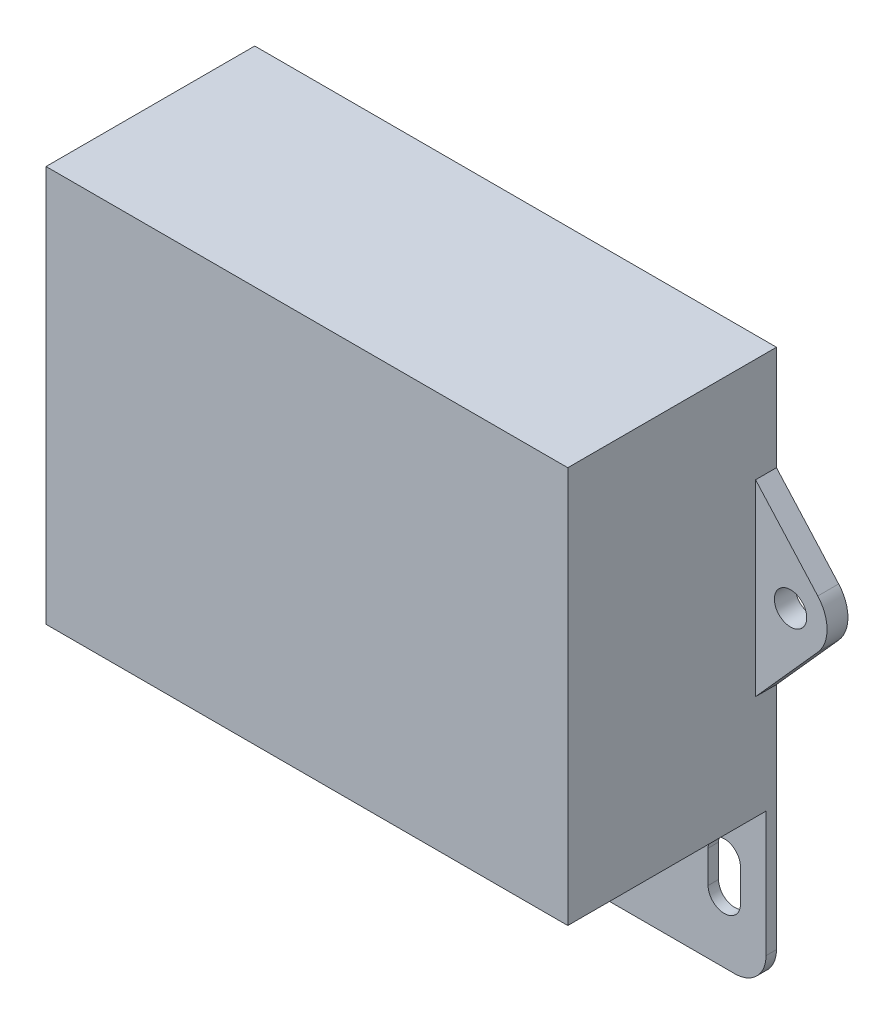
from build123d import *

# Parameters (mm, degrees)
SKETCH1_W                  = 50
SKETCH1_H                  = 38
MAIN_BODY_DEPTH            = 10
SIDE_MOUNTING_BODY_DEPTH   = 2
F_3_1_3_1_DIAMETER_HOLE1_D = 3.1
SKETCH5_W                  = 48
SKETCH5_H                  = 18
BOTTOM_CUT_DEPTH           = 2.6
SKETCH6_W                  = 50
SKETCH6_H                  = 1
BOTTOM_MOUNTING_TAB_DEPTH  = 15
SLOT_DEPTH                 = 51.313243783
FILLET1_R                  = 1.5
FILLET2_R                  = 3


with BuildPart() as part:
    # Sketch1 → MAIN BODY (new, symmetric)
    with BuildSketch(Plane.XY):
        Rectangle(SKETCH1_W, SKETCH1_H)
    extrude(amount=MAIN_BODY_DEPTH, both=True)

    # Sketch2 → SIDE MOUNTING BODY (add)
    with BuildSketch(Plane(origin=(0, 0, -10), x_dir=(-1, 0, 0), z_dir=(0, 0, -1))):
        with BuildLine():
            Line((30.959543616, -2.332441235), (25, -9))
            Line((25, -9), (25, 9))
            Line((25, 9), (30.959543616, 2.332441235))
            ThreePointArc((30.959543616, 2.332441235), (31.85, 0), (30.959543616, -2.332441235))
        make_face()
    side_mounting_body = extrude(amount=-SIDE_MOUNTING_BODY_DEPTH)

    # Mirror1: SIDE MOUNTING BODY across plane
    add(side_mounting_body.mirror(Plane(origin=(0, 0, 0), x_dir=(0, 0, 1), z_dir=(1, 0, 0))))

    # Ø3.1 (3.1) Diameter Hole1 (through all)
    with Locations(Plane.XY.offset(-8)):
        with Locations((-28.35, 0), (28.35, 0)):
            Hole(F_3_1_3_1_DIAMETER_HOLE1_D / 2)

    # Sketch5 → BOTTOM CUT (cut)
    with BuildSketch(Plane(origin=(0, -19, 0), x_dir=(-1, 0, 0), z_dir=(0, -1, 0))):
        Rectangle(SKETCH5_W, SKETCH5_H)
    extrude(amount=-BOTTOM_CUT_DEPTH, mode=Mode.SUBTRACT)

    # Sketch6 → BOTTOM MOUNTING TAB (add)
    with BuildSketch(Plane(origin=(0, -19, 0), x_dir=(-1, 0, 0), z_dir=(0, -1, 0))):
        with Locations((0, 9.5)):
            Rectangle(SKETCH6_W, SKETCH6_H)
    extrude(amount=BOTTOM_MOUNTING_TAB_DEPTH)

    # Sketch7 → SLOT (cut, through all)
    with BuildSketch(Plane.XY.offset(-9)):
        with BuildLine():
            Line((-19.45, -24.85), (-19.45, -27.95))
            ThreePointArc((-19.45, -27.95), (-21, -29.5), (-22.55, -27.95))
            Line((-22.55, -27.95), (-22.55, -24.85))
            ThreePointArc((-22.55, -24.85), (-21, -23.3), (-19.45, -24.85))
        make_face()
    slot = extrude(amount=-SLOT_DEPTH, mode=Mode.SUBTRACT)

    # Mirror2: SLOT across plane
    add(slot.mirror(Plane(origin=(0, 0, 0), x_dir=(0, 0, 1), z_dir=(1, 0, 0))), mode=Mode.SUBTRACT)

    # Fillet1
    fillet1_edges = [part.edges().sort_by_distance(p)[0] for p in [
        (24, -16.4, 0),
        (24, -17.7, 9),
        (0, -16.4, -9),
        (24, -17.7, -9),
        (-24, -16.4, 0),
        (-24, -17.7, -9),
        (0, -16.4, 9),
        (-24, -17.7, 9),
    ]]
    fillet(fillet1_edges, radius=FILLET1_R)

    # Fillet2
    fillet2_edges = [part.edges().sort_by_distance(p)[0] for p in [
        (25, -34, -9.5),
        (-25, -34, -9.5),
    ]]
    fillet(fillet2_edges, radius=FILLET2_R)


solid = part.part
